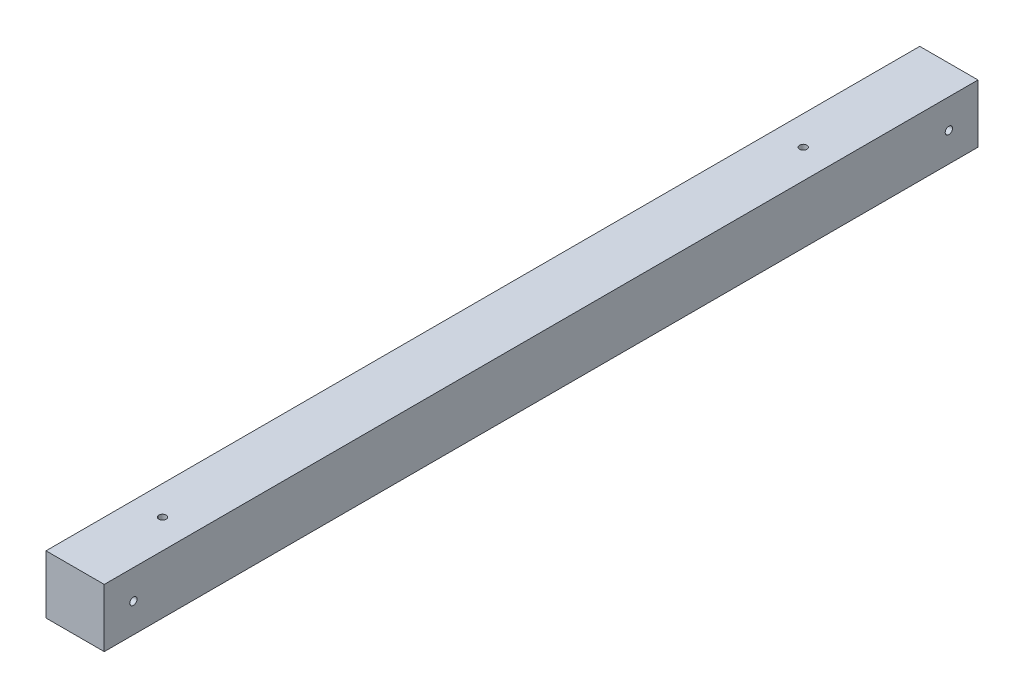
from build123d import *

# Parameters (mm, degrees)
SKETCH6_W                    = 25.4
SKETCH6_H                    = 25.4
BOSS_EXTRUDE1_DEPTH          = 381
F_1_8_0_125_DIAMETER_HOLE2_D = 3.175
F_1_8_0_125_DIAMETER_HOLE3_D = 3.175


with BuildPart() as part:
    # Sketch6 → Boss-Extrude1 (new body)
    with BuildSketch(Plane.XY):
        Rectangle(SKETCH6_W, SKETCH6_H)
    extrude(amount=BOSS_EXTRUDE1_DEPTH)

    # 1/8 (0.125) Diameter Hole2 (through all)
    with Locations(Plane(origin=(12.7, 0, 0), x_dir=(0, 0, -1), z_dir=(1, 0, 0))):
        with Locations((-12.7, 0), (-368.3, 0)):
            Hole(F_1_8_0_125_DIAMETER_HOLE2_D / 2)

    # 1/8 (0.125) Diameter Hole3 (through all)
    with Locations(Plane(origin=(0, 12.7, 0), x_dir=(1, 0, 0), z_dir=(0, 1, 0))):
        with Locations((0, -63.5), (0, -342.9)):
            Hole(F_1_8_0_125_DIAMETER_HOLE3_D / 2)


solid = part.part
